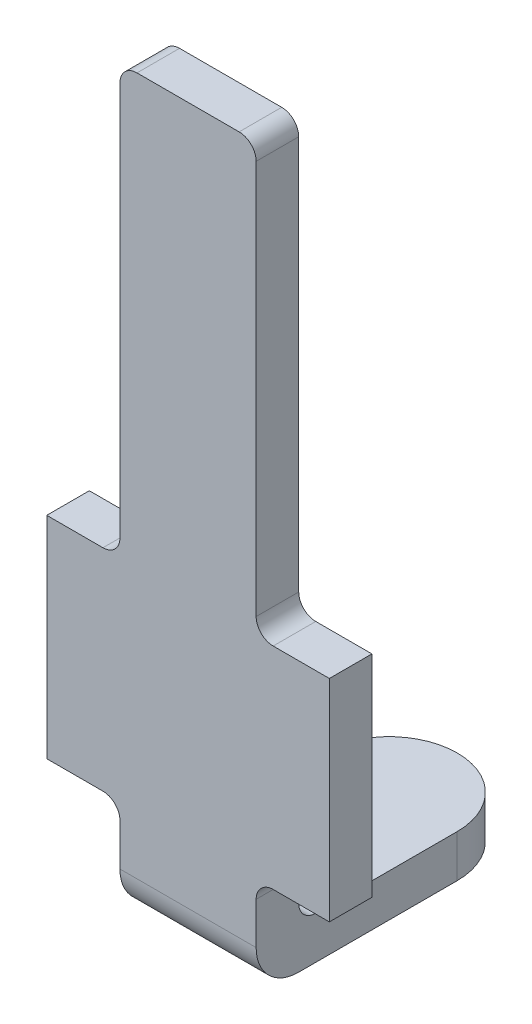
from build123d import *

# Parameters (mm, degrees)
BOSS_EXTRUDE1_DEPTH = 4.35
SKETCH2_W           = 1.825069899
SKETCH2_H           = 4.1
CUT_EXTRUDE1_DEPTH  = 5.491814778
SKETCH3_W           = 0.25
SKETCH3_H           = 3.754034185
BOSS_EXTRUDE2_DEPTH = 0.43
SKETCH4_W           = 0.25
SKETCH4_H           = 3.754034185
BOSS_EXTRUDE3_DEPTH = 0.43
SKETCH5_W           = 0.43
SKETCH5_H           = 2.515624486
CUT_EXTRUDE2_DEPTH  = 18.82293918
SKETCH6_W           = 0.43
SKETCH6_H           = 2.515624486
CUT_EXTRUDE3_DEPTH  = 18.82293918
FILLET1_R           = 0.1
FILLET2_R           = 0.25


with BuildPart() as part:
    # Sketch1 → Boss-Extrude1 (new body)
    with BuildSketch(Plane(origin=(0, 3.9, 0), x_dir=(1, 0, 0), z_dir=(0, 1, 0))):
        with BuildLine():
            Line((-16.91, 0.499), (-16.11, 0.499))
            Line((-16.11, 0.499), (-16.11, 1.68))
            ThreePointArc((-16.11, 1.68), (-16.51, 2.08), (-16.91, 1.68))
            Line((-16.91, 1.68), (-16.91, 0.499))
        make_face()
    extrude(amount=-BOSS_EXTRUDE1_DEPTH)

    # Sketch2 → Cut-Extrude1 (cut, through all)
    with BuildSketch(Plane(origin=(-16.11, 0, 0), x_dir=(0, 0, -1), z_dir=(1, 0, 0))):
        with Locations((1.66153495, 1.85)):
            Rectangle(SKETCH2_W, SKETCH2_H)
    extrude(amount=-CUT_EXTRUDE1_DEPTH, mode=Mode.SUBTRACT)

    # Sketch3 → Boss-Extrude2 (add)
    with BuildSketch(Plane(origin=(-16.11, 0, 0), x_dir=(0, 0, -1), z_dir=(1, 0, 0))):
        with Locations((0.624, 2.022982908)):
            Rectangle(SKETCH3_W, SKETCH3_H)
    extrude(amount=BOSS_EXTRUDE2_DEPTH)

    # Sketch4 → Boss-Extrude3 (add)
    with BuildSketch(Plane.ZY.offset(16.91)):
        with Locations((-0.624, 2.022982908)):
            Rectangle(SKETCH4_W, SKETCH4_H)
    extrude(amount=BOSS_EXTRUDE3_DEPTH)

    # Sketch5 → Cut-Extrude2 (cut, through all)
    with BuildSketch(Plane(origin=(0, 0, -0.749), x_dir=(-1, 0, 0), z_dir=(0, 0, -1))):
        with Locations((15.895, 2.642187757)):
            Rectangle(SKETCH5_W, SKETCH5_H)
    extrude(amount=-CUT_EXTRUDE2_DEPTH, mode=Mode.SUBTRACT)

    # Sketch6 → Cut-Extrude3 (cut, through all)
    with BuildSketch(Plane(origin=(0, 0, -0.749), x_dir=(-1, 0, 0), z_dir=(0, 0, -1))):
        with Locations((17.125, 2.642187757)):
            Rectangle(SKETCH6_W, SKETCH6_H)
    extrude(amount=-CUT_EXTRUDE3_DEPTH, mode=Mode.SUBTRACT)

    # Fillet1
    fillet1_edges = [part.edges().sort_by_distance(p)[0] for p in [
        (-16.51, -0.2, -0.749),
        (-16.11, 0.145965815, -0.624),
        (-16.91, 0.145965815, -0.624),
        (-16.11, 3.9, -0.624),
        (-16.11, 1.384375514, -0.624),
        (-16.91, 1.384375514, -0.624),
        (-16.91, 3.9, -0.624),
    ]]
    fillet(fillet1_edges, radius=FILLET1_R)

    # Fillet2
    fillet2_edges = [part.edges().sort_by_distance(p)[0] for p in [
        (-16.51, -0.45, -0.499),
    ]]
    fillet(fillet2_edges, radius=FILLET2_R)


solid = part.part
